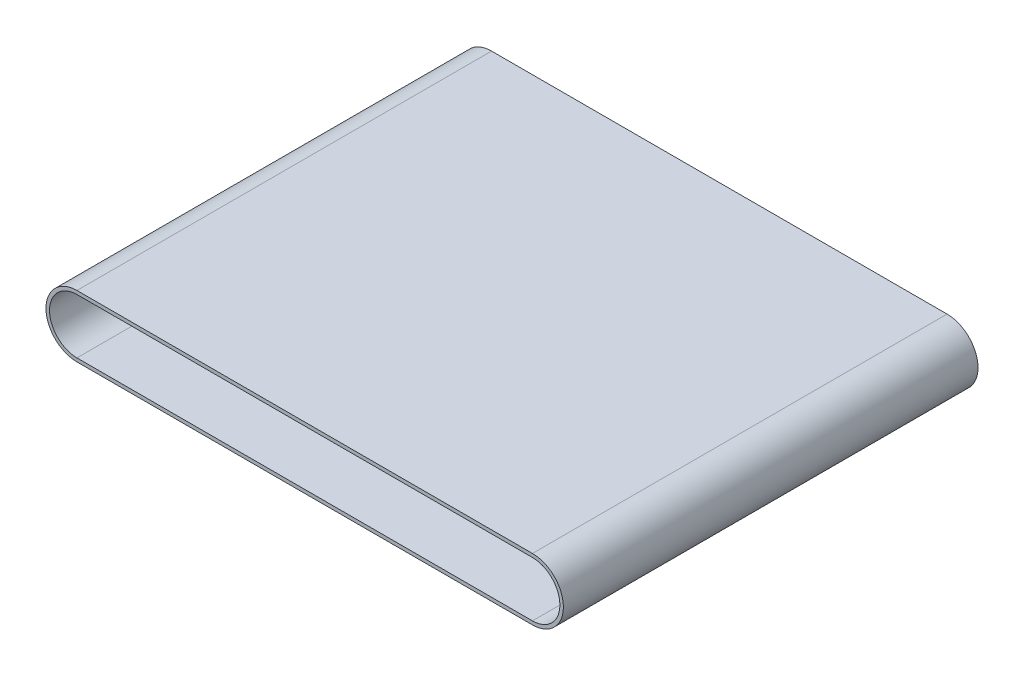
from build123d import *

# Parameters (mm, degrees)
BOSS_EXTRUDE1_DEPTH = 355


with BuildPart() as part:
    # Sketch1 → Boss-Extrude1 (new body)
    with BuildSketch(Plane.XY.offset(177.5)):
        with BuildLine():
            Line((-390, -26.5), (0, -26.5))
            ThreePointArc((0, -26.5), (26.5, 0), (0, 26.5))
            Line((0, 26.5), (-390, 26.5))
            ThreePointArc((-390, 26.5), (-416.5, 0), (-390, -26.5))
        make_face()
        with BuildLine():
            Line((0, -23.5), (-390, -23.5))
            ThreePointArc((-390, -23.5), (-413.5, 0), (-390, 23.5))
            Line((-390, 23.5), (0, 23.5))
            ThreePointArc((0, 23.5), (23.5, 0), (0, -23.5))
        make_face(mode=Mode.SUBTRACT)
    extrude(amount=-BOSS_EXTRUDE1_DEPTH)


solid = part.part
